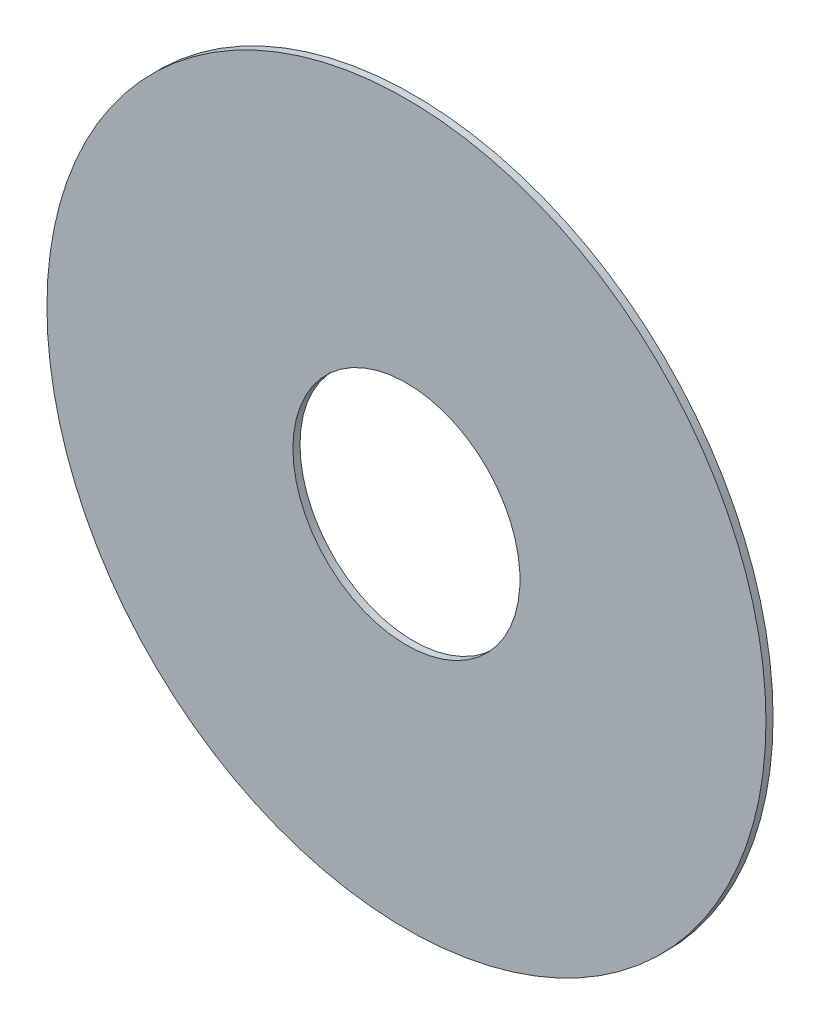
from build123d import *

# Parameters (mm, degrees)
SKETCH1_R           = 241.3
SKETCH1_R_2         = 76.2
BOSS_EXTRUDE1_DEPTH = 4.7625


with BuildPart() as part:
    # Sketch1 → Boss-Extrude1 (new body)
    with BuildSketch(Plane.XY):
        with Locations(Location((0, 0, 0), (0, 0, 180))):
            Circle(SKETCH1_R)
        with Locations(Location((0, 0, 0), (0, 0, 180))):
            Circle(SKETCH1_R_2, mode=Mode.SUBTRACT)
    extrude(amount=BOSS_EXTRUDE1_DEPTH)


solid = part.part
